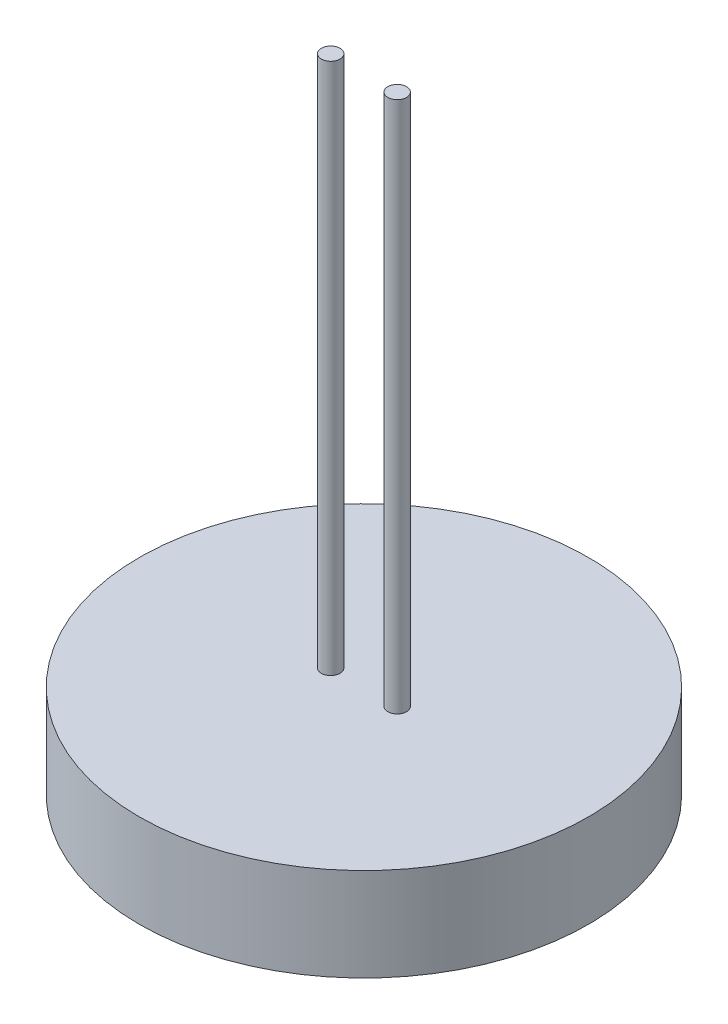
from build123d import *

# Parameters (mm, degrees)
SKETCH2_R                = 16.891
BOSS_EXTRUDE1_DEPTH      = 7
BOSS_EXTRUDE2_DEPTH      = 40
BOSS_EXTRUDE2_DEPTH_BACK = 17
SKETCH3_R                = 0.703637869


with BuildPart() as part:
    # Sketch2 → Boss-Extrude1 (new body)
    with BuildSketch(Plane(origin=(0, 0, 0), x_dir=(1, 0, 0), z_dir=(0, 1, 0))):
        with Locations(Location((0, 0, 0), (0, 0, 270))):
            Circle(SKETCH2_R)
    extrude(amount=BOSS_EXTRUDE1_DEPTH)

    # Sketch3 → Boss-Extrude2 (add, two sides: drawn at the far end of the back side and taken through both)
    with BuildSketch(Plane(origin=(0, 7, 0), x_dir=(1, 0, 0), z_dir=(0, 1, 0)).offset(-BOSS_EXTRUDE2_DEPTH_BACK)):
        with Locations(Location((-2.5, 0, 0), (0, 0, 270))):
            Circle(SKETCH3_R)
        with Locations(Location((2.5, 0, 0), (0, 0, 270))):
            Circle(SKETCH3_R)
    extrude(amount=BOSS_EXTRUDE2_DEPTH + BOSS_EXTRUDE2_DEPTH_BACK)


solid = part.part
